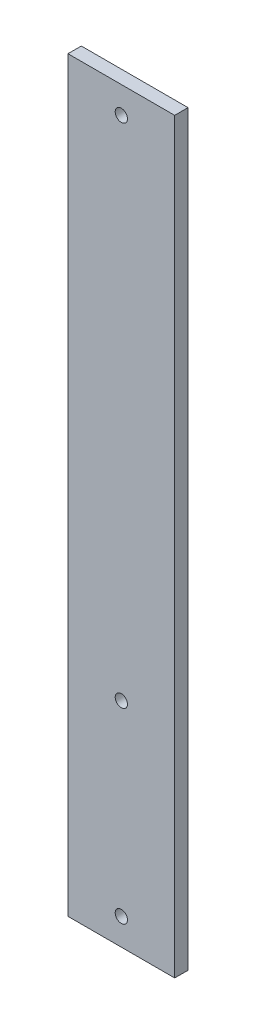
from build123d import *

# Parameters (mm, degrees)
SKETCH2_W           = 25.4
SKETCH2_H           = 177.8
SKETCH2_R           = 1.4605
BOSS_EXTRUDE1_DEPTH = 3.175


with BuildPart() as part:
    # Sketch2 → Boss-Extrude1 (new body)
    with BuildSketch(Plane.XY):
        with Locations((12.7, 88.9)):
            Rectangle(SKETCH2_W, SKETCH2_H)
        with Locations((12.7, 171.45)):
            Circle(SKETCH2_R, mode=Mode.SUBTRACT)
        with Locations((12.7, 50.8)):
            Circle(SKETCH2_R, mode=Mode.SUBTRACT)
        with Locations((12.7, 6.35)):
            Circle(SKETCH2_R, mode=Mode.SUBTRACT)
    extrude(amount=BOSS_EXTRUDE1_DEPTH)


solid = part.part
